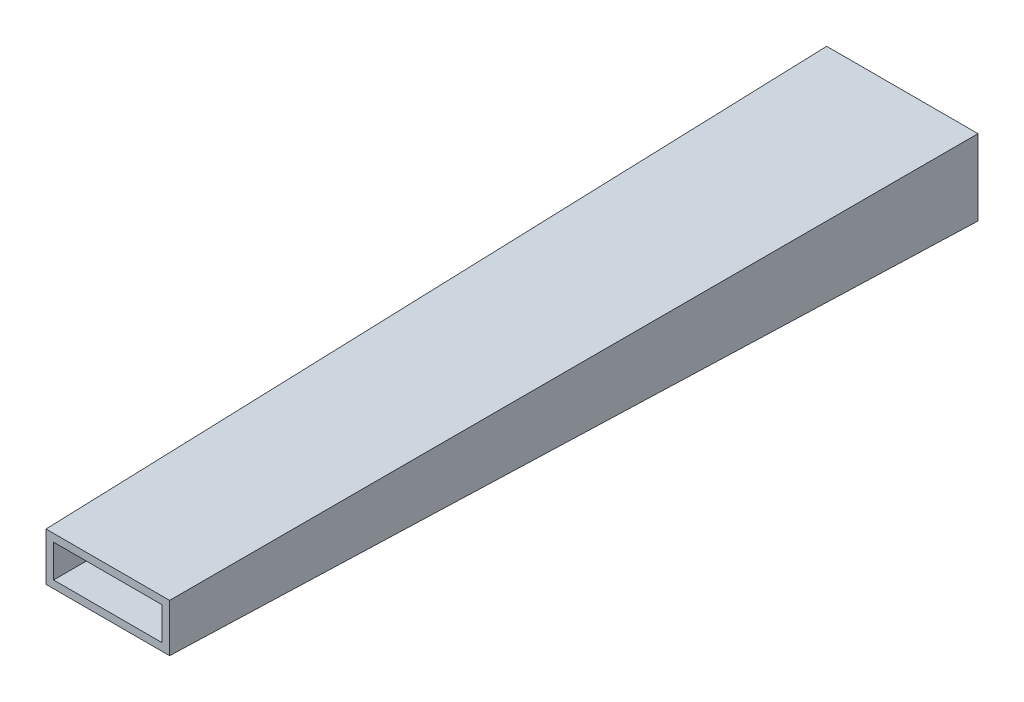
from build123d import *

# Parameters (mm, degrees)
SKETCH2_W           = 200
SKETCH2_H           = 100
BOSS_EXTRUDE1_DEPTH = 1050
BOSS_EXTRUDE1_TAPER = 1
SHELL1_T            = -10


with BuildPart() as part:
    # Sketch2 → Boss-Extrude1 (new body)
    with BuildSketch(Plane.XY):
        Rectangle(SKETCH2_W, SKETCH2_H)
    extrude(amount=BOSS_EXTRUDE1_DEPTH, taper=BOSS_EXTRUDE1_TAPER)

    # Shell1
    shell1_openings = [part.faces().sort_by_distance(p)[0] for p in [
        (0, 0, 1050),
        (0, 0, 0),
    ]]
    offset(amount=SHELL1_T, openings=shell1_openings, kind=Kind.INTERSECTION)


solid = part.part
